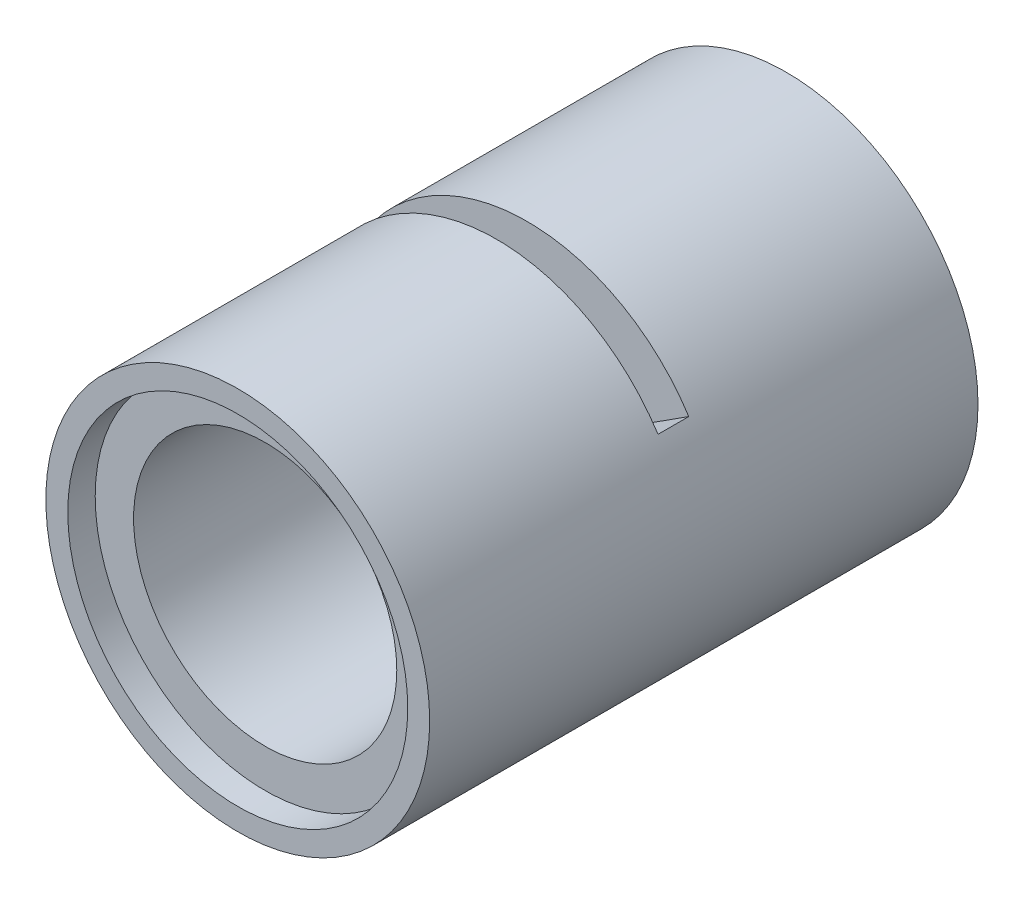
from build123d import *

# Parameters (mm, degrees)
SKETCH1_R           = 3.5
BOSS_EXTRUDE1_DEPTH = 10
SKETCH3_R           = 2.4
CUT_EXTRUDE1_DEPTH  = 12.157956802
SKETCH4_R           = 3.1
CUT_EXTRUDE2_DEPTH  = 0.5
WRAP1_SECTION_W     = 1
WRAP1_SECTION_H     = 0.5606788
WRAP1_ANGLE         = 114.591559026


with BuildPart() as part:
    # Sketch1 → Boss-Extrude1 (new body)
    with BuildSketch(Plane.XY):
        Circle(SKETCH1_R)
    extrude(amount=BOSS_EXTRUDE1_DEPTH)

    # Sketch3 → Cut-Extrude1 (cut, through all)
    with BuildSketch(Plane.XY.offset(10)):
        Circle(SKETCH3_R)
    extrude(amount=-CUT_EXTRUDE1_DEPTH, mode=Mode.SUBTRACT)

    # Sketch4 → Cut-Extrude2 (cut)
    with BuildSketch(Plane.XY.offset(10)):
        Circle(SKETCH4_R)
    cut_extrude2 = extrude(amount=-CUT_EXTRUDE2_DEPTH, mode=Mode.SUBTRACT)

    # Mirror1: Cut-Extrude2 across plane
    add(cut_extrude2.mirror(Plane.XY.offset(5)), mode=Mode.SUBTRACT)

    # Wrap1 section (on wrap section) → Wrap1 (revolve, cut)
    with BuildSketch(Plane(origin=(0, 0, 0), x_dir=(-0.8414709848078967, 0.5403023058681393, 0), z_dir=(-0.5403023058681393, -0.8414709848078967, 0))):
        with Locations((3, -5)):
            Rectangle(WRAP1_SECTION_W, WRAP1_SECTION_H)
    revolve(axis=Axis((0, 0, 0), (0, 0, -1)), revolution_arc=WRAP1_ANGLE, mode=Mode.SUBTRACT)


solid = part.part
